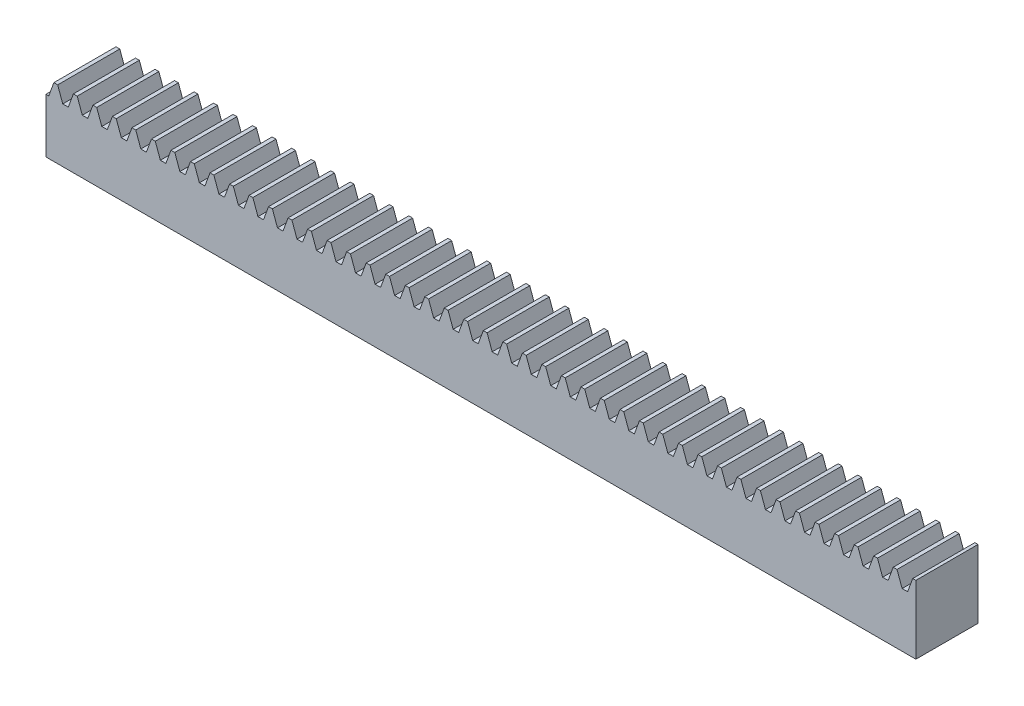
from build123d import *

# Parameters (mm, degrees)
BLANKSKE_W        = 140
BLANKSKE_H        = 11
BLANK_DEPTH       = 10
TOOTHCUTSIM_DEPTH = 141.78707327
TEETHCUTS_COUNT   = 46
TEETHCUTS_PITCH   = 3.14159265


with BuildPart() as part:
    # BlankSke → Blank (new body)
    with BuildSketch(Plane.XY):
        with Locations((70, 5.5)):
            Rectangle(BLANKSKE_W, BLANKSKE_H)
    extrude(amount=-BLANK_DEPTH)

    # TooCutSkeSim → ToothCutSim (cut, through all)
    with BuildSketch(Plane.XY):
        Polygon((0.44443537, 8.75), (-0.44443537, 8.75), (-1.272613241, 11.0254), (1.272613241, 11.0254), align=None)
    toothcutsim = extrude(amount=-TOOTHCUTSIM_DEPTH, mode=Mode.SUBTRACT)

    # TeethCuts: ToothCutSim ×46
    with Locations(*[(i * TEETHCUTS_PITCH, 0, 0) for i in range(1, TEETHCUTS_COUNT)]):
        add(toothcutsim, mode=Mode.SUBTRACT)


solid = part.part
